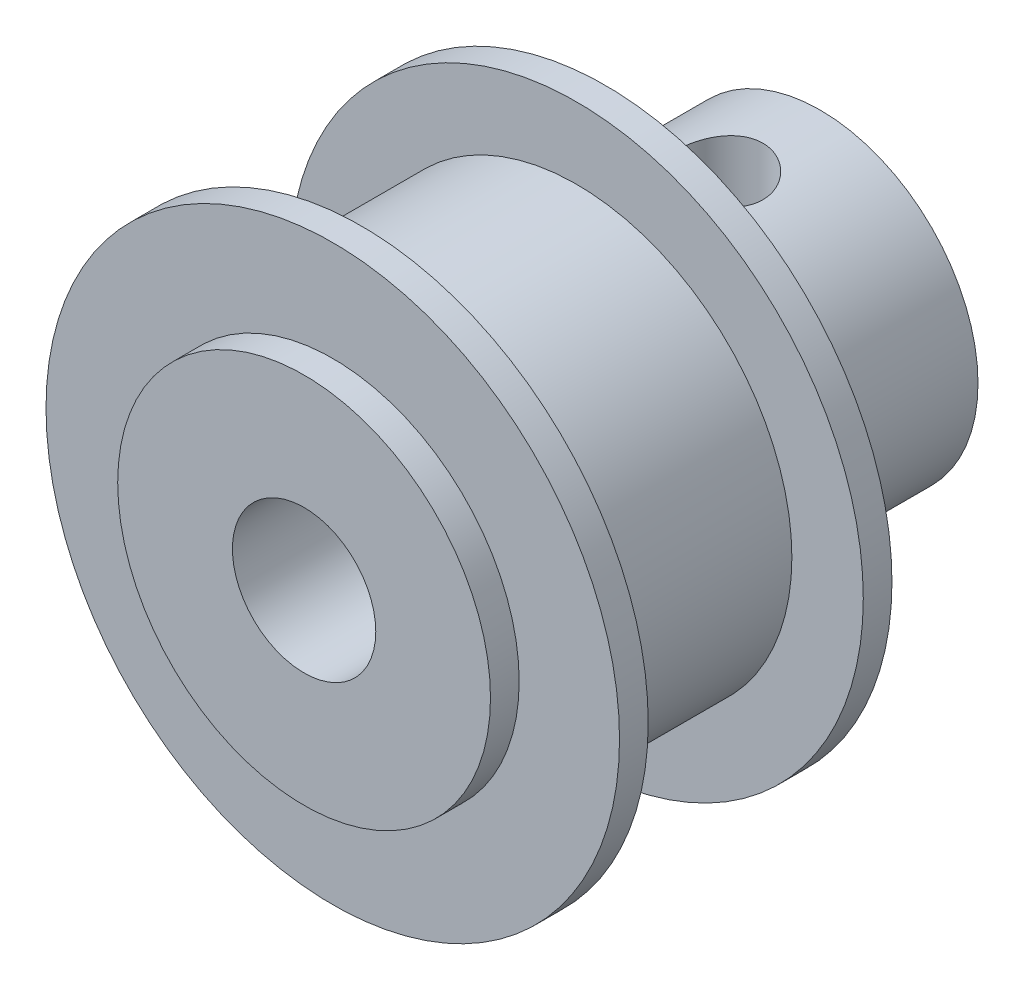
from build123d import *

# Parameters (mm, degrees)
SKETCH1_R                 = 5.5
BOSS_EXTRUDE1_DEPTH       = 6.5
SKETCH2_R                 = 6.5
BOSS_EXTRUDE2_DEPTH       = 1
SKETCH3_R                 = 10
BOSS_EXTRUDE3_DEPTH       = 1
SKETCH4_R                 = 7.51
BOSS_EXTRUDE4_DEPTH       = 7.5
SKETCH5_R                 = 10
BOSS_EXTRUDE5_DEPTH       = 1
SKETCH6_R                 = 6.5
BOSS_EXTRUDE6_DEPTH       = 1
SKETCH7_R                 = 2.5
CUT_EXTRUDE1_DEPTH        = 23.891046285
F_3_0MM_DOWEL_HOLE1_D     = 3
F_3_0MM_DOWEL_HOLE1_DEPTH = 5.5
F_3_0MM_DOWEL_HOLE1_TIP   = 0.901290929


with BuildPart() as part:
    # Sketch1 → Boss-Extrude1 (new body)
    with BuildSketch(Plane.XY):
        with Locations(Location((0, 0, 0), (0, 0, 180))):
            Circle(SKETCH1_R)
    extrude(amount=BOSS_EXTRUDE1_DEPTH)

    # Sketch2 → Boss-Extrude2 (add)
    with BuildSketch(Plane.XY.offset(6.5)):
        Circle(SKETCH2_R)
    extrude(amount=BOSS_EXTRUDE2_DEPTH)

    # Sketch3 → Boss-Extrude3 (add)
    with BuildSketch(Plane.XY.offset(7.5)):
        Circle(SKETCH3_R)
    extrude(amount=BOSS_EXTRUDE3_DEPTH)

    # Sketch4 → Boss-Extrude4 (add)
    with BuildSketch(Plane.XY.offset(8.5)):
        Circle(SKETCH4_R)
    extrude(amount=BOSS_EXTRUDE4_DEPTH)

    # Sketch5 → Boss-Extrude5 (add)
    with BuildSketch(Plane.XY.offset(16)):
        Circle(SKETCH5_R)
    extrude(amount=BOSS_EXTRUDE5_DEPTH)

    # Sketch6 → Boss-Extrude6 (add)
    with BuildSketch(Plane.XY.offset(17)):
        Circle(SKETCH6_R)
    extrude(amount=BOSS_EXTRUDE6_DEPTH)

    # Sketch7 → Cut-Extrude1 (cut, through all)
    with BuildSketch(Plane.XY.offset(18)):
        Circle(SKETCH7_R)
    extrude(amount=-CUT_EXTRUDE1_DEPTH, mode=Mode.SUBTRACT)

    # Ø3.0mm Dowel Hole1
    with Locations(Plane(origin=(0, 5.5, 3.5), x_dir=(1, 0, 0), z_dir=(0, 1, 0))):
        with Locations((0, 0)):
            Hole(F_3_0MM_DOWEL_HOLE1_D / 2, depth=F_3_0MM_DOWEL_HOLE1_DEPTH)
            with Locations((0, 0, -(F_3_0MM_DOWEL_HOLE1_DEPTH + F_3_0MM_DOWEL_HOLE1_TIP / 2))):  # 118° drill point
                Cone(0, F_3_0MM_DOWEL_HOLE1_D / 2, F_3_0MM_DOWEL_HOLE1_TIP, mode=Mode.SUBTRACT)


solid = part.part
